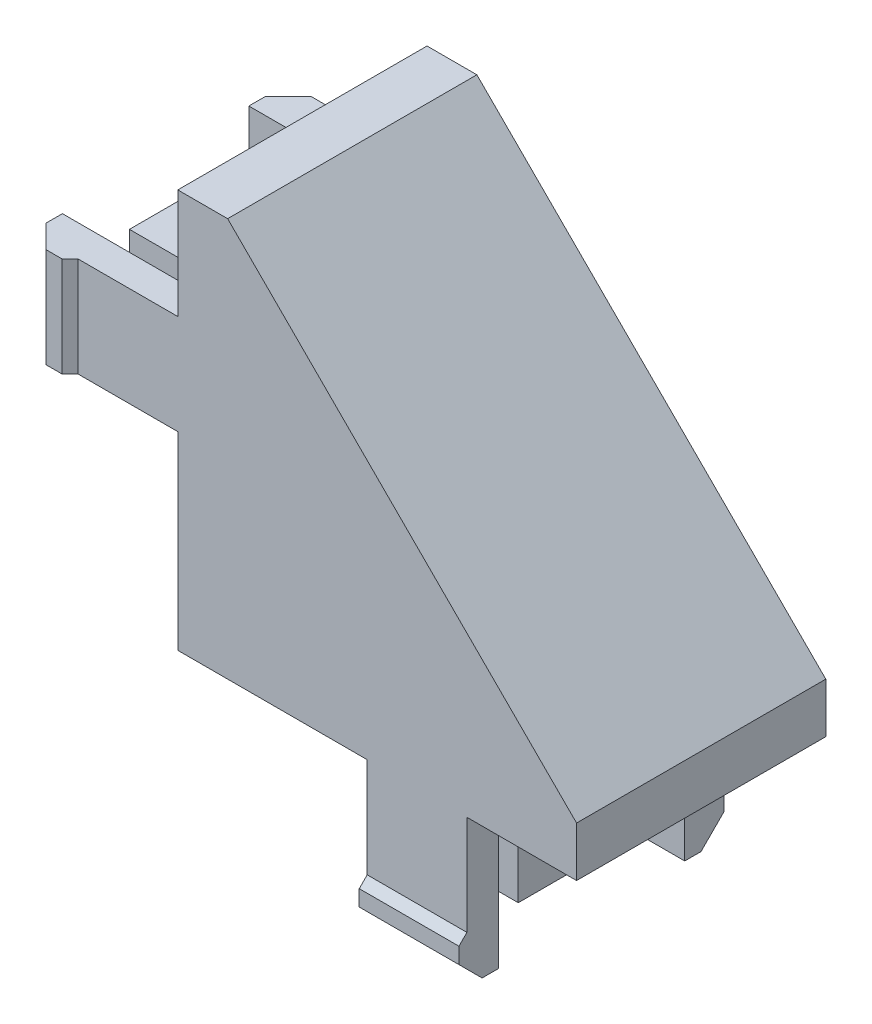
from build123d import *

# Parameters (mm, degrees)
BOSS_EXTRUDE1_DEPTH = 15.875
SKETCH2_W           = 15.875
SKETCH2_H           = 6.35
BOSS_EXTRUDE2_DEPTH = 6.35
BOSS_EXTRUDE3_DEPTH = 6.35
SKETCH4_W           = 6.35
SKETCH4_H           = 1.27
CUT_EXTRUDE1_DEPTH  = 6.35


with BuildPart() as part:
    # Sketch1 → Boss-Extrude1 (new body)
    with BuildSketch(Plane.XY):
        Polygon((0, 0), (0, 25.4), (3.175, 25.4), (25.4, 3.175), (25.4, 0), align=None)
    extrude(amount=BOSS_EXTRUDE1_DEPTH)

    # Sketch2 → Boss-Extrude2 (add)
    with BuildSketch(Plane.ZY):
        with Locations((7.9375, 15.24)):
            Rectangle(SKETCH2_W, SKETCH2_H)
    boss_extrude2 = extrude(amount=BOSS_EXTRUDE2_DEPTH)

    # Sketch3 → Boss-Extrude3 (add)
    with BuildSketch(Plane(origin=(0, 18.415, 0), x_dir=(1, 0, 0), z_dir=(0, 1, 0))):
        Polygon((-9.35, -14.907), (-9.35, -13.875), (-6.35, -13.875), (-6.35, -15.875), (-6.858, -16.383), (-7.874, -16.383), align=None)
        Polygon((-7.874, 0.508), (-9.35, -0.968), (-9.35, -2), (-6.35, -2), (-6.35, 0), (-6.858, 0.508), align=None)
    boss_extrude3 = extrude(amount=-BOSS_EXTRUDE3_DEPTH)

    # Sketch4 → Cut-Extrude1 (cut)
    with BuildSketch(Plane(origin=(0, 18.415, 0), x_dir=(1, 0, 0), z_dir=(0, 1, 0))):
        with Locations((-3.175, -13.24)):
            Rectangle(SKETCH4_W, SKETCH4_H)
        with Locations((-3.175, -2.635)):
            Rectangle(SKETCH4_W, SKETCH4_H)
    cut_extrude1 = extrude(amount=-CUT_EXTRUDE1_DEPTH, mode=Mode.SUBTRACT)

    # Mirror1: Boss-Extrude2, Boss-Extrude3, Cut-Extrude1 across plane
    add(boss_extrude2.mirror(Plane(origin=(0, 0, 0), x_dir=(0, 0, 1), z_dir=(0.7071067811865476, -0.7071067811865476, 0))))
    add(boss_extrude3.mirror(Plane(origin=(0, 0, 0), x_dir=(0, 0, 1), z_dir=(0.7071067811865476, -0.7071067811865476, 0))))
    add(cut_extrude1.mirror(Plane(origin=(0, 0, 0), x_dir=(0, 0, 1), z_dir=(0.7071067811865476, -0.7071067811865476, 0))), mode=Mode.SUBTRACT)


solid = part.part
